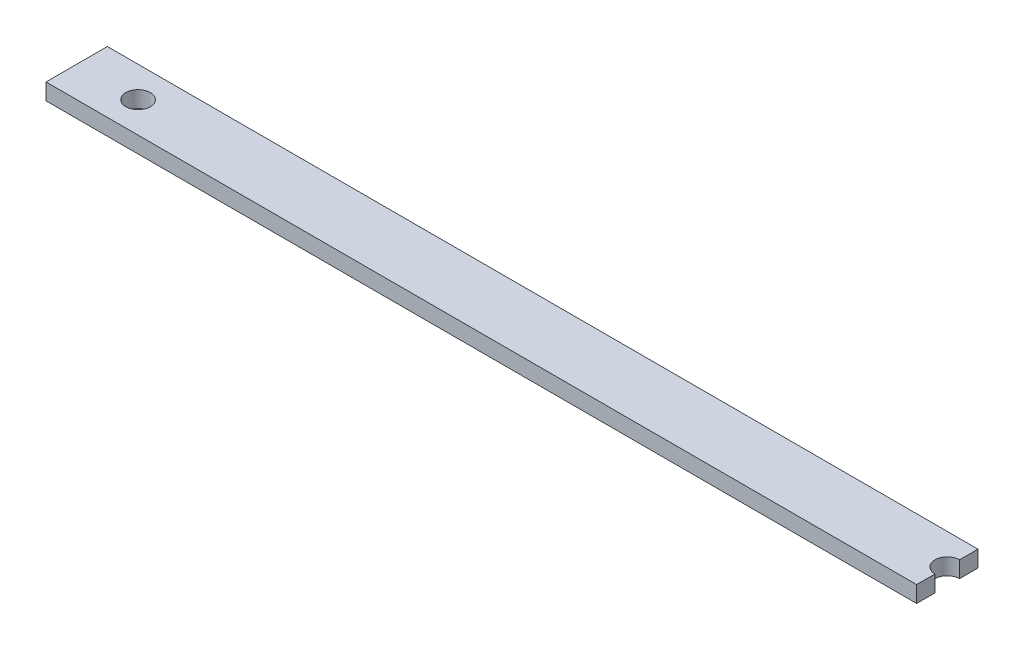
from build123d import *

# Parameters (mm, degrees)
SKETCH1_W           = 212.750000014
SKETCH1_H           = 15
BOSS_EXTRUDE1_DEPTH = 4
SKETCH2_R           = 3
CUT_EXTRUDE1_DEPTH  = 107.714060116


with BuildPart() as part:
    # Sketch1 → Boss-Extrude1 (new body)
    with BuildSketch(Plane(origin=(0, 0, 0), x_dir=(1, 0, 0), z_dir=(0, 1, 0))):
        Rectangle(SKETCH1_W, SKETCH1_H)
    extrude(amount=BOSS_EXTRUDE1_DEPTH)

    # Sketch2 → Cut-Extrude1 (cut, through all)
    with BuildSketch(Plane(origin=(0, 4, 0), x_dir=(1, 0, 0), z_dir=(0, 1, 0))):
        with Locations(Location((-91.375000007, 0, 0), (0, 0, 270))):
            Circle(SKETCH2_R)
        with Locations((106.375000007, 0)):
            Circle(SKETCH2_R)
    extrude(amount=-CUT_EXTRUDE1_DEPTH, mode=Mode.SUBTRACT)


solid = part.part
